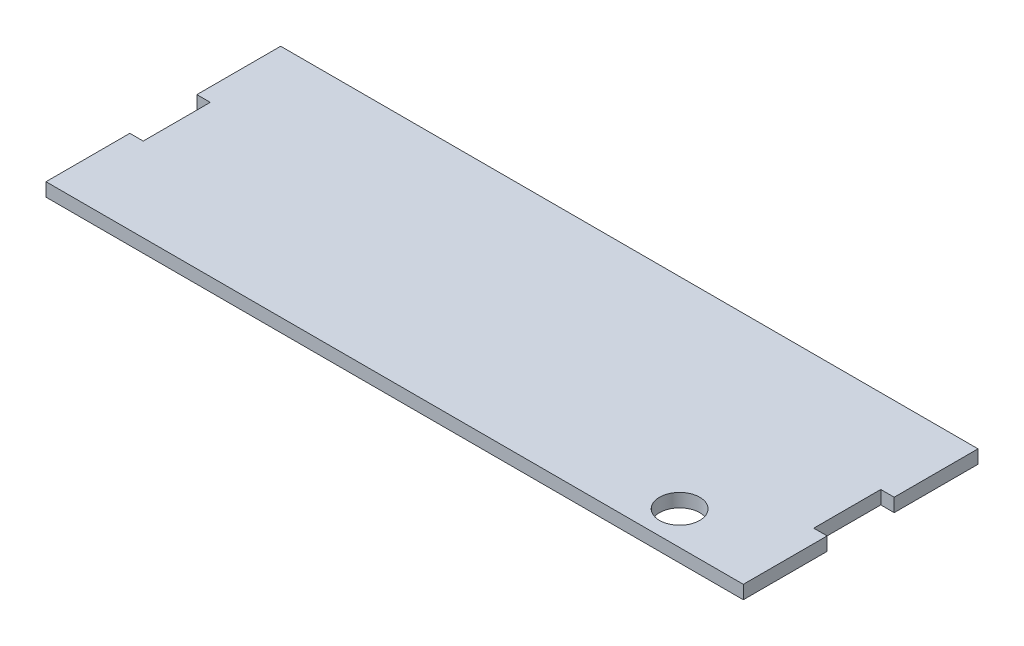
from build123d import *

# Parameters (mm, degrees)
SKETCH1_R           = 6
SKETCH1_W           = 4
SKETCH1_H           = 25
BOSS_EXTRUDE1_DEPTH = 4


with BuildPart() as part:
    # Sketch1 → Boss-Extrude1 (new body)
    # profile 1 of 5: a face of its own
    with BuildSketch(Plane(origin=(0, 0, 0), x_dir=(1, 0, 0), z_dir=(0, 1, 0))):
        Polygon((0, 25), (0, 0), (200, 0), (200, 25), (200, 45), (200, 70), (0, 70), (0, 45), align=None)
        with Locations(Location((175, 10, 0), (0, 0, 270))):
            Circle(SKETCH1_R, mode=Mode.SUBTRACT)
    # profile 2 of 5: a face of its own
    with BuildSketch(Plane(origin=(0, 0, 0), x_dir=(1, 0, 0), z_dir=(0, 1, 0))):
        with Locations((-2, 12.5)):
            Rectangle(SKETCH1_W, SKETCH1_H)
    # profile 3 of 5: a face of its own
    with BuildSketch(Plane(origin=(0, 0, 0), x_dir=(1, 0, 0), z_dir=(0, 1, 0))):
        with Locations((202, 12.5)):
            Rectangle(SKETCH1_W, SKETCH1_H)
    # profile 4 of 5: a face of its own
    with BuildSketch(Plane(origin=(0, 0, 0), x_dir=(1, 0, 0), z_dir=(0, 1, 0))):
        with Locations((-2, 57.5)):
            Rectangle(SKETCH1_W, SKETCH1_H)
    # profile 5 of 5: a face of its own
    with BuildSketch(Plane(origin=(0, 0, 0), x_dir=(1, 0, 0), z_dir=(0, 1, 0))):
        with Locations((202, 57.5)):
            Rectangle(SKETCH1_W, SKETCH1_H)
    extrude(amount=BOSS_EXTRUDE1_DEPTH)


solid = part.part
